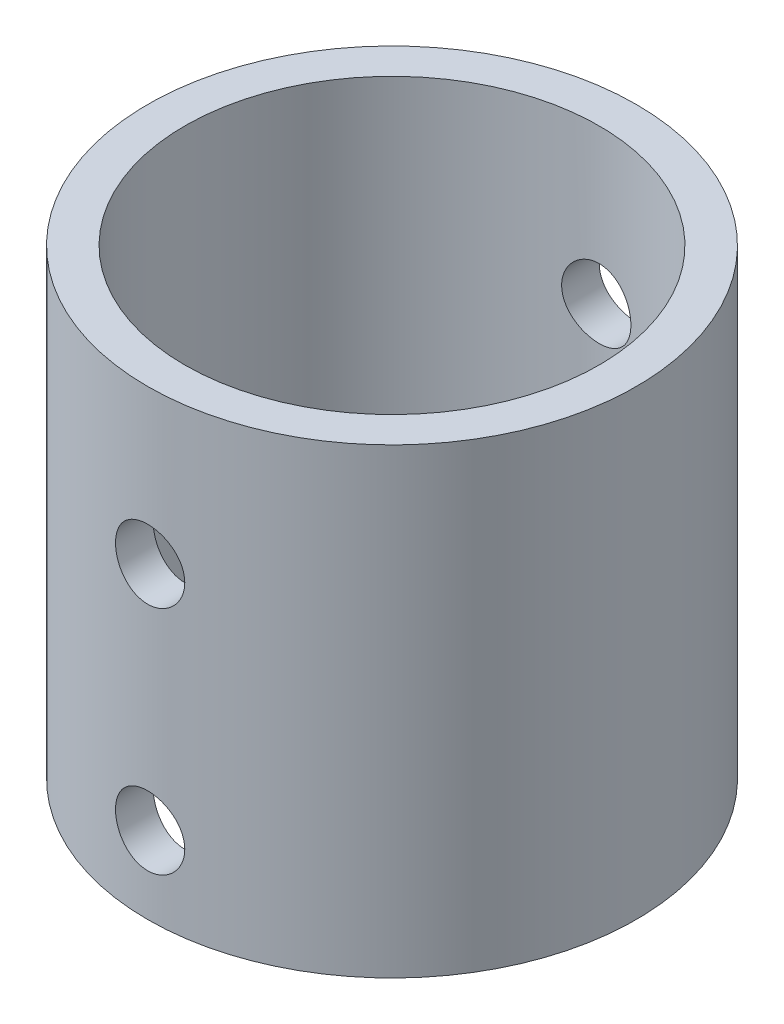
from build123d import *

# Parameters (mm, degrees)
SKETCH1_R               = 15.875
SKETCH1_R_2             = 13.462
BOSS_EXTRUDE1_DEPTH     = 30
CUT_EXTRUDE1_DEPTH      = 30
CUT_EXTRUDE1_DEPTH_BACK = 30
SKETCH2_R               = 2.25


with BuildPart() as part:
    # Sketch1 → Boss-Extrude1 (new body)
    with BuildSketch(Plane(origin=(0, 0, 0), x_dir=(1, 0, 0), z_dir=(0, 1, 0))):
        Circle(SKETCH1_R)
        Circle(SKETCH1_R_2, mode=Mode.SUBTRACT)
    extrude(amount=-BOSS_EXTRUDE1_DEPTH)

    # Sketch2 → Cut-Extrude1 (cut, two sides: drawn at the far end of the back side and taken through both)
    with BuildSketch(Plane.XY.offset(-CUT_EXTRUDE1_DEPTH_BACK)):
        with Locations((0, -25)):
            Circle(SKETCH2_R)
        with Locations((0, -10)):
            Circle(SKETCH2_R)
    extrude(amount=CUT_EXTRUDE1_DEPTH + CUT_EXTRUDE1_DEPTH_BACK, mode=Mode.SUBTRACT)


solid = part.part
